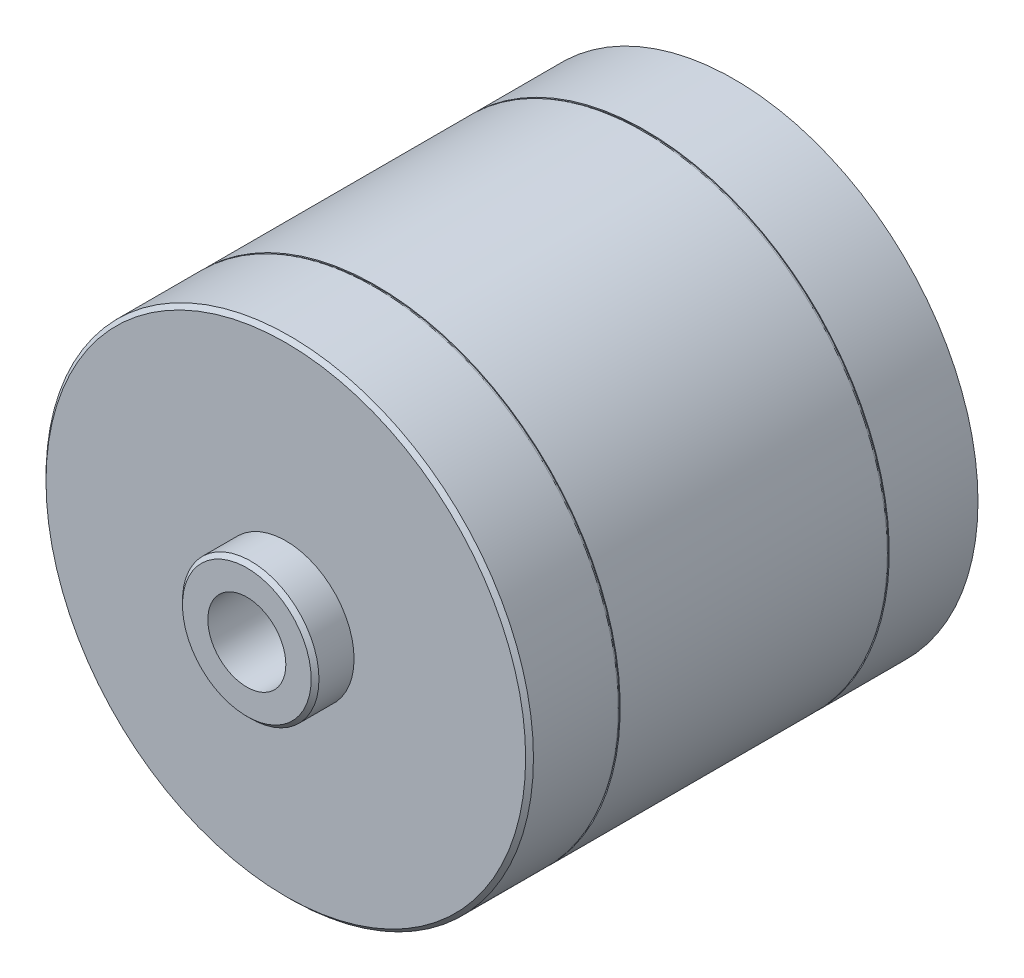
from build123d import *

# Parameters (mm, degrees)
CROQUIS1_R              = 12.5
SALIENTE_EXTRUIR1_DEPTH = 23
CROQUIS2_R              = 3.5
SALIENTE_EXTRUIR2_DEPTH = 2
CROQUIS3_R              = 2
CORTAR_EXTRUIR2_DEPTH   = 6
CHAFL_N2_SIZE           = 0.2
CROQUIS4_W              = 0.1
CROQUIS4_H              = 0.1
CHAFL_N3_SIZE           = 0.2


with BuildPart() as part:
    # Croquis1 → Saliente-Extruir1 (new body)
    with BuildSketch(Plane.XY):
        Circle(CROQUIS1_R)
    extrude(amount=SALIENTE_EXTRUIR1_DEPTH)

    # Croquis2 → Saliente-Extruir2 (add)
    with BuildSketch(Plane.XY.offset(23)):
        Circle(CROQUIS2_R)
    extrude(amount=SALIENTE_EXTRUIR2_DEPTH)

    # Croquis3 → Cortar-Extruir2 (cut)
    with BuildSketch(Plane.XY.offset(25)):
        Circle(CROQUIS3_R)
    extrude(amount=-CORTAR_EXTRUIR2_DEPTH, mode=Mode.SUBTRACT)

    # Chaflán2
    chafl_n2_edges = [part.edges().sort_by_distance(p)[0] for p in [
        (-12.5, 0, 23),
    ]]
    chamfer(chafl_n2_edges, length=CHAFL_N2_SIZE)

    # Croquis4 → Cortar-Revolución1 (revolve, cut)
    with BuildSketch(Plane(origin=(0, 0, 0), x_dir=(1, 0, 0), z_dir=(0, 1, 0))):
        with Locations((-12.5, -4.6)):
            Rectangle(CROQUIS4_W, CROQUIS4_H)
        with Locations((-12.5, -18.4)):
            Rectangle(CROQUIS4_W, CROQUIS4_H)
    revolve(axis=Axis((0, 0, 0), (0, 0, 1)), mode=Mode.SUBTRACT)

    # Chaflán3
    chafl_n3_edges = [part.edges().sort_by_distance(p)[0] for p in [
        (-3.5, 0, 25),
    ]]
    chamfer(chafl_n3_edges, length=CHAFL_N3_SIZE)


solid = part.part
